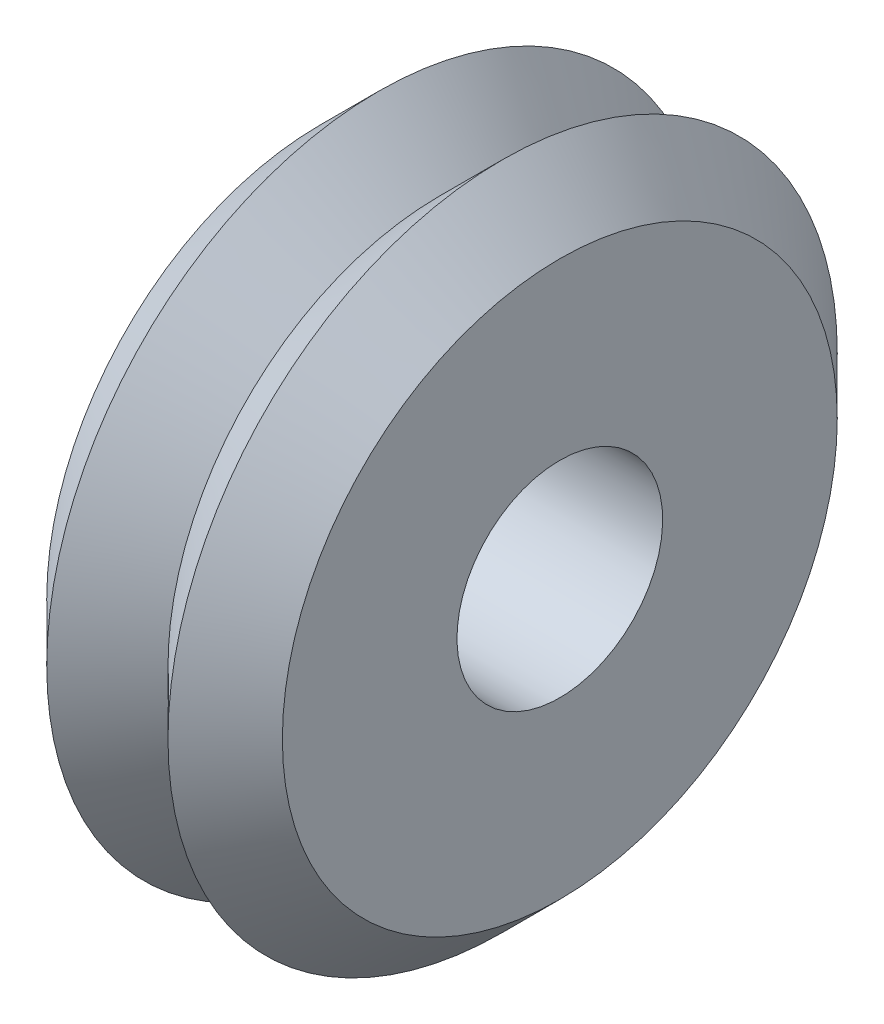
from build123d import *

# Parameters (mm, degrees)
SKETCH2_R          = 4.7625
CUT_EXTRUDE1_DEPTH = 34.995099077


with BuildPart() as part:
    # Sketch1 → Revolve1 (revolve)
    with BuildSketch(Plane.XY):
        Polygon((0, 0), (2.71145, 2.71145), (5.51815, -0.09525), (8.45185, 2.83845), (11.0998, 0.1905), (11.0998, -12.65555), (0, -12.65555), align=None)
    revolve(axis=Axis((11.0998, -12.65555, 0), (-1, 0, 0)))

    # Sketch2 → Cut-Extrude1 (cut, through all)
    with BuildSketch(Plane(origin=(11.0998, 0, 0), x_dir=(0, 0, -1), z_dir=(1, 0, 0))):
        with Locations(Location((0, -12.65555, 0), (0, 0, 90))):
            Circle(SKETCH2_R)
    extrude(amount=-CUT_EXTRUDE1_DEPTH, mode=Mode.SUBTRACT)


solid = part.part
